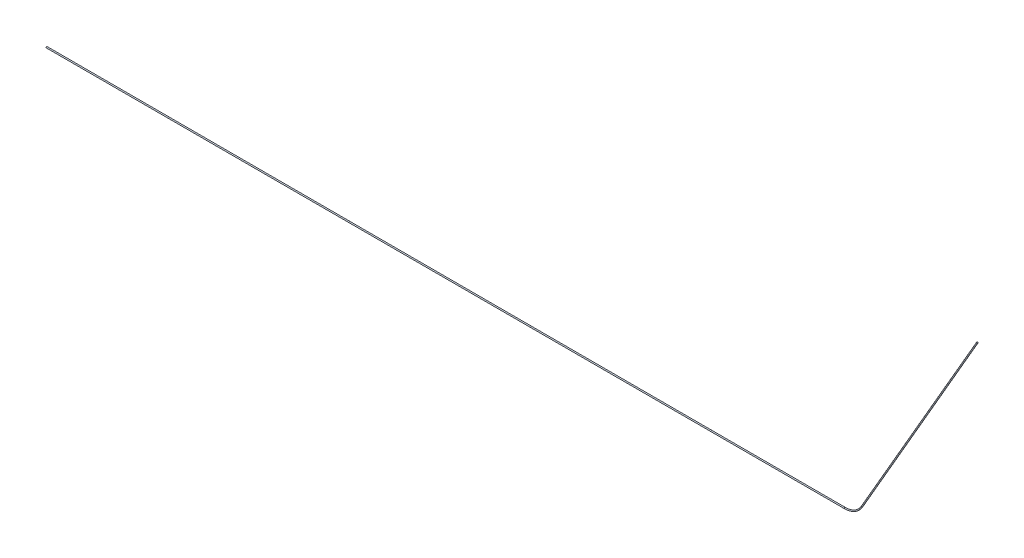
from build123d import *

# Parameters (mm, degrees)
SKETCH1_R = 0.875


with BuildPart() as part:
    # Sweep1: sweep along a path in Sketch2
    with BuildLine(Plane.XY) as sweep1_path:
        Line((0, 0), (1219.2, 0))
        ThreePointArc((1219.2, 0), (1234.2, 4.019237886), (1245.180762114, 15))
        Line((1245.180762114, 15), (1421.157124163, 319.8))
    # Sketch1 → Sweep1 (sweep)
    with BuildSketch(Plane(origin=(0, 0, 0), x_dir=(0, 0, -1), z_dir=(1, 0, 0))):
        Circle(SKETCH1_R)
    sweep(path=sweep1_path.line)


solid = part.part
